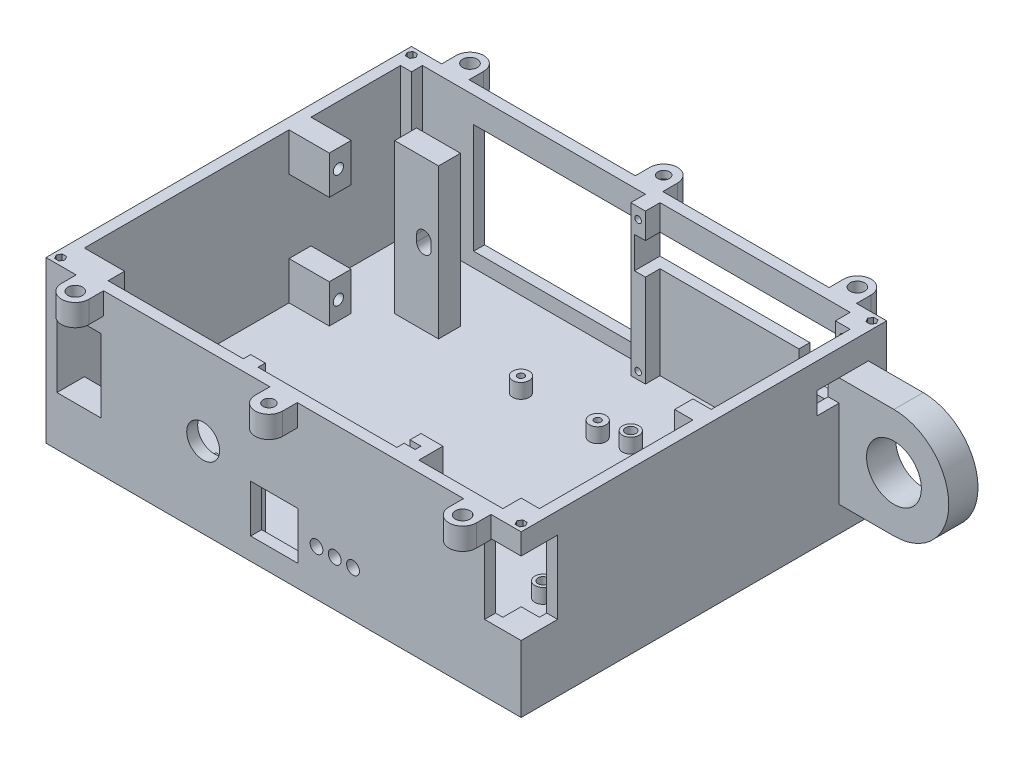
from build123d import *

# Parameters (mm, degrees)
SKETCH1_W           = 130
SKETCH1_H           = 100
BOSS_EXTRUDE1_DEPTH = 44
CUT_EXTRUDE1_DEPTH  = 41
CUT_EXTRUDE2_REACH  = 171.812
SKETCH4_W           = 12
SKETCH4_H           = 20
SKETCH11_R          = 1.4
CUT_EXTRUDE6_DEPTH  = 11
SKETCH12_W          = 46
SKETCH12_H          = 30
CUT_EXTRUDE7_DEPTH  = 3
SKETCH14_R          = 4.5
CUT_EXTRUDE8_DEPTH  = 3
SKETCH15_W          = 5
SKETCH15_H          = 5
SKETCH15_R          = 1.4
BOSS_EXTRUDE2_DEPTH = 3
SKETCH20_W          = 4
SKETCH20_H          = 2
BOSS_EXTRUDE3_DEPTH = 41
SKETCH21_W          = 8
SKETCH21_H          = 30
BOSS_EXTRUDE4_DEPTH = 30
SKETCH23_R          = 7.5
CUT_EXTRUDE9_DEPTH  = 8
SKETCH24_W          = 6
SKETCH24_H          = 6
CUT_EXTRUDE10_DEPTH = 3
SKETCH25_R          = 1
CUT_EXTRUDE11_DEPTH = 3
SKETCH26_R          = 2.25
SKETCH26_R_2        = 0.9
BOSS_EXTRUDE5_DEPTH = 4
SKETCH27_R          = 0.9
CUT_EXTRUDE12_DEPTH = 5
CUT_EXTRUDE13_REACH = 195.742
SKETCH28_W          = 6
SKETCH28_H          = 20
CUT_EXTRUDE14_REACH = 195.742
SKETCH30_R          = 0.9
CUT_EXTRUDE15_DEPTH = 4
SKETCH31_R          = 1.75
SKETCH31_W          = 13
SKETCH31_H          = 13
CUT_EXTRUDE16_DEPTH = 3
SKETCH34_W          = 12
SKETCH34_H          = 6
BOSS_EXTRUDE6_DEPTH = 41
CUT_EXTRUDE17_DEPTH = 6
SKETCH36_R          = 2
SKETCH36_R_2        = 1.6
BOSS_EXTRUDE7_DEPTH = 6
SKETCH37_R          = 2
CUT_EXTRUDE18_DEPTH = 4
SKETCH38_R          = 2.25
SKETCH38_R_2        = 1.4
BOSS_EXTRUDE8_DEPTH = 4
SKETCH40_W          = 5
SKETCH40_H          = 20
CUT_EXTRUDE20_DEPTH = 52
SKETCH41_W          = 4
SKETCH41_H          = 20
CUT_EXTRUDE21_DEPTH = 10
CUT_EXTRUDE22_DEPTH = 2.3


with BuildPart() as part:
    # Sketch1 → Boss-Extrude1 (new body)
    with BuildSketch(Plane(origin=(0, 0, 0), x_dir=(1, 0, 0), z_dir=(0, 1, 0))):
        with Locations((65, -50)):
            Rectangle(SKETCH1_W, SKETCH1_H)
    extrude(amount=BOSS_EXTRUDE1_DEPTH)

    # Sketch3 → Cut-Extrude1 (cut)
    with BuildSketch(Plane(origin=(0, 44, 0), x_dir=(1, 0, 0), z_dir=(0, 1, 0))):
        Polygon((14, -3), (67, -3), (67, -7), (71, -7), (71, -3), (123, -3), (123, -7), (127, -7), (127, -45), (122, -45), (122, -50), (127, -50), (127, -92), (122, -92), (122, -97), (14, -97), (14, -92.5), (3, -92.5), (3, -36.5), (14, -36.5), (14, -30.5), (3, -30.5), (3, -6), (6, -6), (6, -3), align=None)
    extrude(amount=-CUT_EXTRUDE1_DEPTH, mode=Mode.SUBTRACT)

    # Cut-Extrude2: up to this face of the body (flat: up to its plane)
    cut_extrude2_end = Plane(part.part.faces().sort_by_distance((8.5, 23.5, 30.5))[0])
    # Sketch4 → Cut-Extrude2 (cut, up to the picked face)
    with BuildSketch(Plane.XY.offset(100), mode=Mode.PRIVATE) as cut_extrude2_sk1:
        with Locations((9, 23.5)):
            Rectangle(SKETCH4_W, SKETCH4_H)
    cut_extrude2_tool1 = split(extrude(cut_extrude2_sk1.sketch, amount=-CUT_EXTRUDE2_REACH, mode=Mode.PRIVATE), bisect_by=cut_extrude2_end, keep=Keep.BOTH, mode=Mode.PRIVATE)
    add(cut_extrude2_tool1.solids().sort_by(Axis((9, 23.5, 100), (0, 0, -1)))[0], mode=Mode.SUBTRACT)

    # Sketch11 → Cut-Extrude6 (cut)
    with BuildSketch(Plane(origin=(14, 0, 0), x_dir=(0, 0, -1), z_dir=(1, 0, 0))):
        with Locations((-95, 39)):
            Circle(SKETCH11_R)
        with Locations((-95, 8)):
            Circle(SKETCH11_R)
        with Locations((-34, 39)):
            Circle(SKETCH11_R)
        with Locations((-34, 8)):
            Circle(SKETCH11_R)
    extrude(amount=-CUT_EXTRUDE6_DEPTH, mode=Mode.SUBTRACT)

    # Sketch12 → Cut-Extrude7 (cut)
    with BuildSketch(Plane(origin=(0, 0, 0), x_dir=(-1, 0, 0), z_dir=(0, 0, -1))):
        with Locations((-43, 22)):
            Rectangle(SKETCH12_W, SKETCH12_H)
    extrude(amount=-CUT_EXTRUDE7_DEPTH, mode=Mode.SUBTRACT)

    # Sketch14 → Cut-Extrude8 (cut)
    with BuildSketch(Plane(origin=(0, 0, 97), x_dir=(-1, 0, 0), z_dir=(0, 0, -1))):
        with Locations((-43, 22)):
            Circle(SKETCH14_R)
    extrude(amount=-CUT_EXTRUDE8_DEPTH, mode=Mode.SUBTRACT)

    # Sketch15 → Boss-Extrude2 (add)
    # profile 1 of 2: a face of its own
    with BuildSketch(Plane(origin=(0, 0, 97), x_dir=(-1, 0, 0), z_dir=(0, 0, -1))):
        with Locations((-43, 31.5)):
            Rectangle(SKETCH15_W, SKETCH15_H)
        with Locations((-43, 31.5)):
            Circle(SKETCH15_R, mode=Mode.SUBTRACT)
    # profile 2 of 2: a face of its own
    with BuildSketch(Plane(origin=(0, 0, 97), x_dir=(-1, 0, 0), z_dir=(0, 0, -1))):
        with Locations((-43, 12.5)):
            Rectangle(SKETCH15_W, SKETCH15_H)
        with Locations((-43, 12.5)):
            Circle(SKETCH15_R, mode=Mode.SUBTRACT)
    extrude(amount=BOSS_EXTRUDE2_DEPTH)

    # Sketch20 → Boss-Extrude3 (add)
    with BuildSketch(Plane(origin=(0, 44, 0), x_dir=(1, 0, 0), z_dir=(0, 1, 0))):
        Polygon((93, -97), (99, -97), (99, -90.4), (93, -90.4), (93, -93.4), (96, -93.4), (96, -95), (93, -95), align=None)
        with Locations((53, -96)):
            Rectangle(SKETCH20_W, SKETCH20_H)
    extrude(amount=-BOSS_EXTRUDE3_DEPTH)

    # Sketch21 → Boss-Extrude4 (add)
    with BuildSketch(Plane(origin=(130, 0, 0), x_dir=(0, 0, -1), z_dir=(1, 0, 0))):
        with Locations((-9, 22)):
            Rectangle(SKETCH21_W, SKETCH21_H)
    extrude(amount=BOSS_EXTRUDE4_DEPTH)

    # Sketch23 → Cut-Extrude9 (cut)
    with BuildSketch(Plane(origin=(0, 0, 5), x_dir=(-1, 0, 0), z_dir=(0, 0, -1))):
        with Locations(Location((-145, 22, 0), (0, 0, 90))):
            Circle(SKETCH23_R)
        with BuildLine():
            Line((-145, 37), (-169.0246399, 37))
            Line((-169.0246399, 37), (-169.0246399, 7))
            Line((-169.0246399, 7), (-145, 7))
            ThreePointArc((-145, 7), (-160, 22), (-145, 37))
        make_face()
    extrude(amount=-CUT_EXTRUDE9_DEPTH, mode=Mode.SUBTRACT)

    # Sketch24 → Cut-Extrude10 (cut)
    with BuildSketch(Plane(origin=(130, 0, 0), x_dir=(0, 0, -1), z_dir=(1, 0, 0))):
        with Locations((-16, 34)):
            Rectangle(SKETCH24_W, SKETCH24_H)
    extrude(amount=-CUT_EXTRUDE10_DEPTH, mode=Mode.SUBTRACT)

    # Sketch25 → Cut-Extrude11 (cut)
    with BuildSketch(Plane(origin=(0, 0, 95), x_dir=(-1, 0, 0), z_dir=(0, 0, -1))):
        with Locations((-53, 41.65)):
            Circle(SKETCH25_R)
        with Locations((-53, 5.35)):
            Circle(SKETCH25_R)
    extrude(amount=-CUT_EXTRUDE11_DEPTH, mode=Mode.SUBTRACT)

    # Sketch26 → Boss-Extrude5 (add)
    # profile 1 of 4: a face of its own
    with BuildSketch(Plane(origin=(0, 3, 0), x_dir=(1, 0, 0), z_dir=(0, 1, 0))):
        with Locations(Location((56, -26.05, 0), (0, 0, 90))):
            Circle(SKETCH26_R)
        with Locations(Location((56, -26.05, 0), (0, 0, 270))):
            Circle(SKETCH26_R_2, mode=Mode.SUBTRACT)
    # profile 2 of 4: a face of its own
    with BuildSketch(Plane(origin=(0, 3, 0), x_dir=(1, 0, 0), z_dir=(0, 1, 0))):
        with Locations(Location((56, -69.55, 0), (0, 0, 90))):
            Circle(SKETCH26_R)
        with Locations(Location((56, -69.55, 0), (0, 0, 270))):
            Circle(SKETCH26_R_2, mode=Mode.SUBTRACT)
    # profile 3 of 4: a face of its own
    with BuildSketch(Plane(origin=(0, 3, 0), x_dir=(1, 0, 0), z_dir=(0, 1, 0))):
        with Locations(Location((77, -26.05, 0), (0, 0, 90))):
            Circle(SKETCH26_R)
        with Locations(Location((77, -26.05, 0), (0, 0, 270))):
            Circle(SKETCH26_R_2, mode=Mode.SUBTRACT)
    # profile 4 of 4: a face of its own
    with BuildSketch(Plane(origin=(0, 3, 0), x_dir=(1, 0, 0), z_dir=(0, 1, 0))):
        with Locations(Location((77, -69.55, 0), (0, 0, 90))):
            Circle(SKETCH26_R)
        with Locations(Location((77, -69.55, 0), (0, 0, 270))):
            Circle(SKETCH26_R_2, mode=Mode.SUBTRACT)
    extrude(amount=BOSS_EXTRUDE5_DEPTH)

    # Sketch27 → Cut-Extrude12 (cut)
    with BuildSketch(Plane.ZY.offset(-122)):
        with Locations((47.75, 40)):
            Circle(SKETCH27_R)
        with Locations((47.75, 16.5)):
            Circle(SKETCH27_R)
        with Locations((94.25, 40)):
            Circle(SKETCH27_R)
        with Locations((94.25, 16.5)):
            Circle(SKETCH27_R)
    extrude(amount=-CUT_EXTRUDE12_DEPTH, mode=Mode.SUBTRACT)

    # Cut-Extrude13: up to this face of the body (flat: up to its plane)
    cut_extrude13_end = Plane(part.part.faces().sort_by_distance((124.5, 23.5, 45))[0])
    # Sketch28 → Cut-Extrude13 (cut, up to the picked face)
    with BuildSketch(Plane.XY.offset(100), mode=Mode.PRIVATE) as cut_extrude13_sk1:
        with Locations((123, 28.25)):
            Rectangle(SKETCH28_W, SKETCH28_H)
    cut_extrude13_tool1 = split(extrude(cut_extrude13_sk1.sketch, amount=-CUT_EXTRUDE13_REACH, mode=Mode.PRIVATE), bisect_by=cut_extrude13_end, keep=Keep.BOTH, mode=Mode.PRIVATE)
    add(cut_extrude13_tool1.solids().sort_by(Axis((123, 28.25, 100), (0, 0, -1)))[0], mode=Mode.SUBTRACT)

    # Cut-Extrude14: up to this face of the body (flat: up to its plane)
    cut_extrude14_end = Plane(part.part.faces().sort_by_distance((69, 23.5, 7))[0])
    # Sketch29 → Cut-Extrude14 (cut, up to the picked face)
    with BuildSketch(Plane(origin=(0, 0, 0), x_dir=(-1, 0, 0), z_dir=(0, 0, -1)), mode=Mode.PRIVATE) as cut_extrude14_sk1:
        Polygon((-123, 37), (-123, 20), (-109, 20), (-109, 28.344695925), (-68, 28.344695925), (-68, 37), align=None)
    cut_extrude14_tool1 = split(extrude(cut_extrude14_sk1.sketch, amount=-CUT_EXTRUDE14_REACH, mode=Mode.PRIVATE), bisect_by=cut_extrude14_end, keep=Keep.BOTH, mode=Mode.PRIVATE)
    add(cut_extrude14_tool1.solids().sort_by(Axis((99.539567, 30.997406, 0), (0, 0, 1)))[0], mode=Mode.SUBTRACT)

    # Sketch30 → Cut-Extrude15 (cut)
    with BuildSketch(Plane.XY.offset(7)):
        with Locations((69, 41)):
            Circle(SKETCH30_R)
        with Locations((69, 5)):
            Circle(SKETCH30_R)
        with Locations((125, 5)):
            Circle(SKETCH30_R)
        with Locations((125, 41)):
            Circle(SKETCH30_R)
    extrude(amount=-CUT_EXTRUDE15_DEPTH, mode=Mode.SUBTRACT)

    # Sketch31 → Cut-Extrude16 (cut)
    with BuildSketch(Plane(origin=(0, 0, 97), x_dir=(-1, 0, 0), z_dir=(0, 0, -1))):
        with Locations((-74, 12.5)):
            Circle(SKETCH31_R)
        with Locations((-79, 12.5)):
            Circle(SKETCH31_R)
        with Locations((-84, 12.5)):
            Circle(SKETCH31_R)
        with Locations((-62.5, 12.5)):
            Rectangle(SKETCH31_W, SKETCH31_H)
    extrude(amount=-CUT_EXTRUDE16_DEPTH, mode=Mode.SUBTRACT)

    # Sketch34 → Boss-Extrude6 (add)
    with BuildSketch(Plane(origin=(0, 3, 0), x_dir=(1, 0, 0), z_dir=(0, 1, 0))):
        with Locations((26, -21.6)):
            Rectangle(SKETCH34_W, SKETCH34_H)
    extrude(amount=BOSS_EXTRUDE6_DEPTH)

    # Sketch35 → Cut-Extrude17 (cut)
    with BuildSketch(Plane(origin=(0, 0, 18.6), x_dir=(-1, 0, 0), z_dir=(0, 0, -1))):
        with BuildLine():
            Line((-30, 24.8), (-30, 23))
            ThreePointArc((-30, 23), (-28, 21), (-26, 23))
            Line((-26, 23), (-26, 24.8))
            ThreePointArc((-26, 24.8), (-28, 26.8), (-30, 24.8))
        make_face()
    extrude(amount=-CUT_EXTRUDE17_DEPTH, mode=Mode.SUBTRACT)

    # Sketch36 → Boss-Extrude7 (add)
    # profile 1 of 6: a face of its own
    with BuildSketch(Plane(origin=(0, 44, 0), x_dir=(1, 0, 0), z_dir=(0, 1, 0))):
        with BuildLine():
            Line((8.25, 4), (8.25, 0))
            Line((8.25, 0), (15.75, 0))
            Line((15.75, 0), (15.75, 4))
            ThreePointArc((15.75, 4), (12, 7.75), (8.25, 4))
        make_face()
        with Locations(Location((12, 4, 0), (0, 0, 270))):
            Circle(SKETCH36_R, mode=Mode.SUBTRACT)
    # profile 2 of 6: a face of its own
    with BuildSketch(Plane(origin=(0, 44, 0), x_dir=(1, 0, 0), z_dir=(0, 1, 0))):
        with BuildLine():
            Line((61.25, 4), (61.25, 0))
            Line((61.25, 0), (68.75, 0))
            Line((68.75, 0), (68.75, 4))
            ThreePointArc((68.75, 4), (65, 7.75), (61.25, 4))
        make_face()
        with Locations(Location((65, 4, 0), (0, 0, 270))):
            Circle(SKETCH36_R_2, mode=Mode.SUBTRACT)
    # profile 3 of 6: a face of its own
    with BuildSketch(Plane(origin=(0, 44, 0), x_dir=(1, 0, 0), z_dir=(0, 1, 0))):
        with BuildLine():
            Line((114.25, 4), (114.25, 0))
            Line((114.25, 0), (121.75, 0))
            Line((121.75, 0), (121.75, 4))
            ThreePointArc((121.75, 4), (118, 7.75), (114.25, 4))
        make_face()
        with Locations(Location((118, 4, 0), (0, 0, 270))):
            Circle(SKETCH36_R, mode=Mode.SUBTRACT)
    # profile 4 of 6: a face of its own
    with BuildSketch(Plane(origin=(0, 44, 0), x_dir=(1, 0, 0), z_dir=(0, 1, 0))):
        with BuildLine():
            Line((8.25, -104), (8.25, -100))
            Line((8.25, -100), (15.75, -100))
            Line((15.75, -100), (15.75, -104))
            ThreePointArc((15.75, -104), (12, -107.75), (8.25, -104))
        make_face()
        with Locations(Location((12, -104, 0), (0, 0, 270))):
            Circle(SKETCH36_R, mode=Mode.SUBTRACT)
    # profile 5 of 6: a face of its own
    with BuildSketch(Plane(origin=(0, 44, 0), x_dir=(1, 0, 0), z_dir=(0, 1, 0))):
        with BuildLine():
            Line((61.25, -104), (61.25, -100))
            Line((61.25, -100), (68.75, -100))
            Line((68.75, -100), (68.75, -104))
            ThreePointArc((68.75, -104), (65, -107.75), (61.25, -104))
        make_face()
        with Locations(Location((65, -104, 0), (0, 0, 270))):
            Circle(SKETCH36_R_2, mode=Mode.SUBTRACT)
    # profile 6 of 6: a face of its own
    with BuildSketch(Plane(origin=(0, 44, 0), x_dir=(1, 0, 0), z_dir=(0, 1, 0))):
        with BuildLine():
            Line((121.75, -104), (121.75, -100))
            Line((121.75, -100), (114.25, -100))
            Line((114.25, -100), (114.25, -104))
            ThreePointArc((114.25, -104), (118, -107.75), (121.75, -104))
        make_face()
        with Locations(Location((118, -104, 0), (0, 0, 270))):
            Circle(SKETCH36_R, mode=Mode.SUBTRACT)
    extrude(amount=-BOSS_EXTRUDE7_DEPTH)

    # Sketch37 → Cut-Extrude18 (cut)
    with BuildSketch(Plane.XZ.offset(-38)):
        with Locations(Location((65, -4, 0), (0, 0, 270))):
            Circle(SKETCH37_R)
    extrude(amount=-CUT_EXTRUDE18_DEPTH, mode=Mode.SUBTRACT)

    # Sketch38 → Boss-Extrude8 (add)
    # profile 1 of 4: a face of its own
    with BuildSketch(Plane(origin=(0, 3, 0), x_dir=(1, 0, 0), z_dir=(0, 1, 0))):
        with Locations(Location((84, -24, 0), (0, 0, 90))):
            Circle(SKETCH38_R)
        with Locations(Location((84, -24, 0), (0, 0, 270))):
            Circle(SKETCH38_R_2, mode=Mode.SUBTRACT)
    # profile 2 of 4: a face of its own
    with BuildSketch(Plane(origin=(0, 3, 0), x_dir=(1, 0, 0), z_dir=(0, 1, 0))):
        with Locations(Location((107.6, -24, 0), (0, 0, 90))):
            Circle(SKETCH38_R)
        with Locations(Location((107.6, -24, 0), (0, 0, 270))):
            Circle(SKETCH38_R_2, mode=Mode.SUBTRACT)
    # profile 3 of 4: a face of its own
    with BuildSketch(Plane(origin=(0, 3, 0), x_dir=(1, 0, 0), z_dir=(0, 1, 0))):
        with Locations(Location((84, -71.6, 0), (0, 0, 90))):
            Circle(SKETCH38_R)
        with Locations(Location((84, -71.6, 0), (0, 0, 270))):
            Circle(SKETCH38_R_2, mode=Mode.SUBTRACT)
    # profile 4 of 4: a face of its own
    with BuildSketch(Plane(origin=(0, 3, 0), x_dir=(1, 0, 0), z_dir=(0, 1, 0))):
        with Locations(Location((107.6, -71.6, 0), (0, 0, 90))):
            Circle(SKETCH38_R)
        with Locations(Location((107.6, -71.6, 0), (0, 0, 270))):
            Circle(SKETCH38_R_2, mode=Mode.SUBTRACT)
    extrude(amount=BOSS_EXTRUDE8_DEPTH)

    # Sketch40 → Cut-Extrude20 (cut)
    with BuildSketch(Plane(origin=(0, 0, 45), x_dir=(-1, 0, 0), z_dir=(0, 0, -1))):
        with Locations((-124.5, 28.25)):
            Rectangle(SKETCH40_W, SKETCH40_H)
    extrude(amount=-CUT_EXTRUDE20_DEPTH, mode=Mode.SUBTRACT)

    # Sketch41 → Cut-Extrude21 (cut)
    with BuildSketch(Plane.XY.offset(100)):
        with Locations((128, 28.25)):
            Rectangle(SKETCH41_W, SKETCH41_H)
    extrude(amount=-CUT_EXTRUDE21_DEPTH, mode=Mode.SUBTRACT)

    # Sketch42 → Cut-Extrude22 (cut)
    with BuildSketch(Plane(origin=(0, 44, 0), x_dir=(1, 0, 0), z_dir=(0, 1, 0))):
        Polygon((3.212435565, -2), (2.606217783, -0.95), (1.393782217, -0.95), (0.787564435, -2), (1.393782217, -3.05), (2.606217783, -3.05), align=None)
        Polygon((126.787564435, -2), (127.393782217, -3.05), (128.606217783, -3.05), (129.212435565, -2), (128.606217783, -0.95), (127.393782217, -0.95), align=None)
        Polygon((126.787564435, -98), (127.393782217, -99.05), (128.606217783, -99.05), (129.212435565, -98), (128.606217783, -96.95), (127.393782217, -96.95), align=None)
        Polygon((3.212435565, -98), (2.606217783, -96.95), (1.393782217, -96.95), (0.787564435, -98), (1.393782217, -99.05), (2.606217783, -99.05), align=None)
    extrude(amount=-CUT_EXTRUDE22_DEPTH, mode=Mode.SUBTRACT)


solid = part.part
